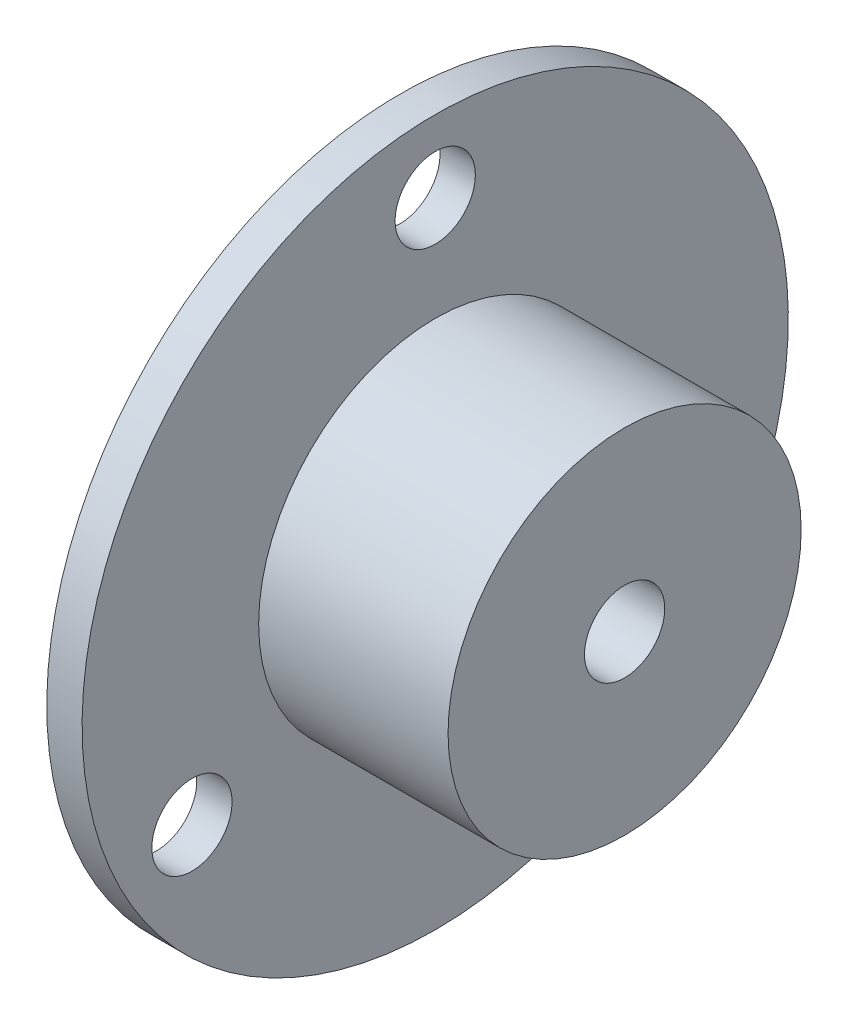
from build123d import *

# Parameters (mm, degrees)
SKETCH_2_R          = 2.5
CUT_EXTRUDE_1_DEPTH = 10
SKETCH_3_R          = 2.5
CUT_EXTRUDE_2_DEPTH = 40.293765409


with BuildPart() as part:
    # 草图1 → 旋转1 (revolve)
    with BuildSketch(Plane.XY):
        Polygon((-10, 0), (14, 0), (14, -11), (2.2, -11), (2.2, -22), (0, -22), (0, -11), (-5, -11), (-5, -4.5), (-10, -4.5), align=None)
    revolve(axis=Axis((-10, 0, 0), (1, 0, 0)))

    # 草图2 → 切除-拉伸1 (cut)
    with BuildSketch(Plane.ZY):
        with Locations((0, 17.5)):
            Circle(SKETCH_2_R)
        with Locations((15.155444566, -8.75)):
            Circle(SKETCH_2_R)
        with Locations((-15.155444566, -8.75)):
            Circle(SKETCH_2_R)
    extrude(amount=-CUT_EXTRUDE_1_DEPTH, mode=Mode.SUBTRACT)

    # 草图3 → 切除-拉伸2 (cut, through all)
    with BuildSketch(Plane.ZY.offset(10)):
        Circle(SKETCH_3_R)
    extrude(amount=-CUT_EXTRUDE_2_DEPTH, mode=Mode.SUBTRACT)


solid = part.part
